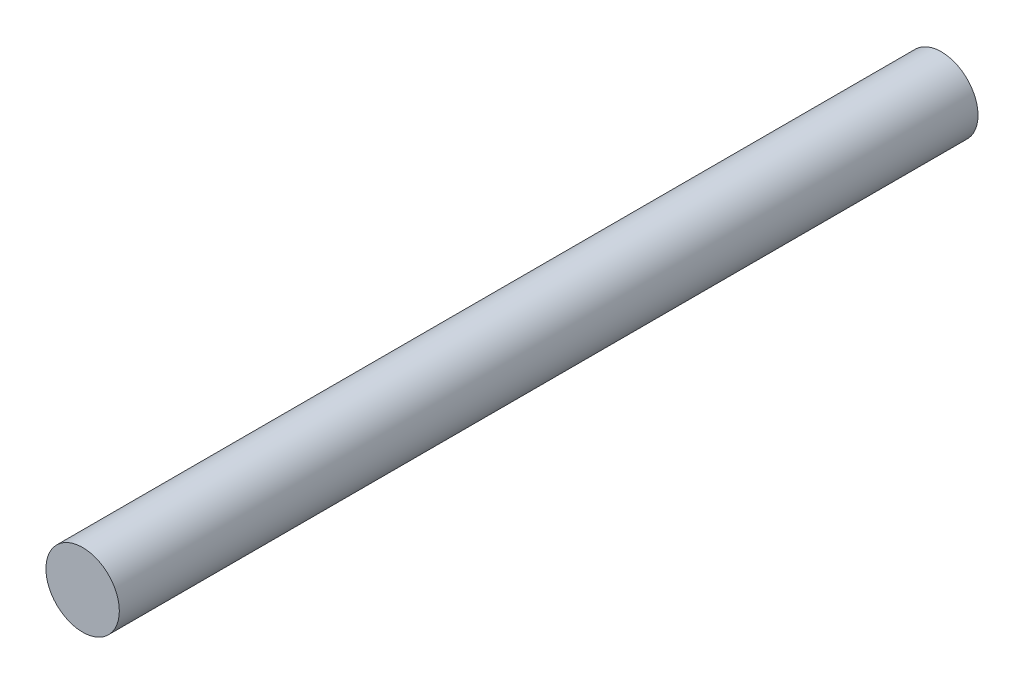
from build123d import *

# Parameters (mm, degrees)
SKETCH_1_R         = 2
EXTRUDE_46_8_DEPTH = 46.8


with BuildPart() as part:
    # 草图1 → 轴向尺寸_46.8 (new body)
    with BuildSketch(Plane.XY):
        Circle(SKETCH_1_R)
    extrude(amount=EXTRUDE_46_8_DEPTH)


solid = part.part
